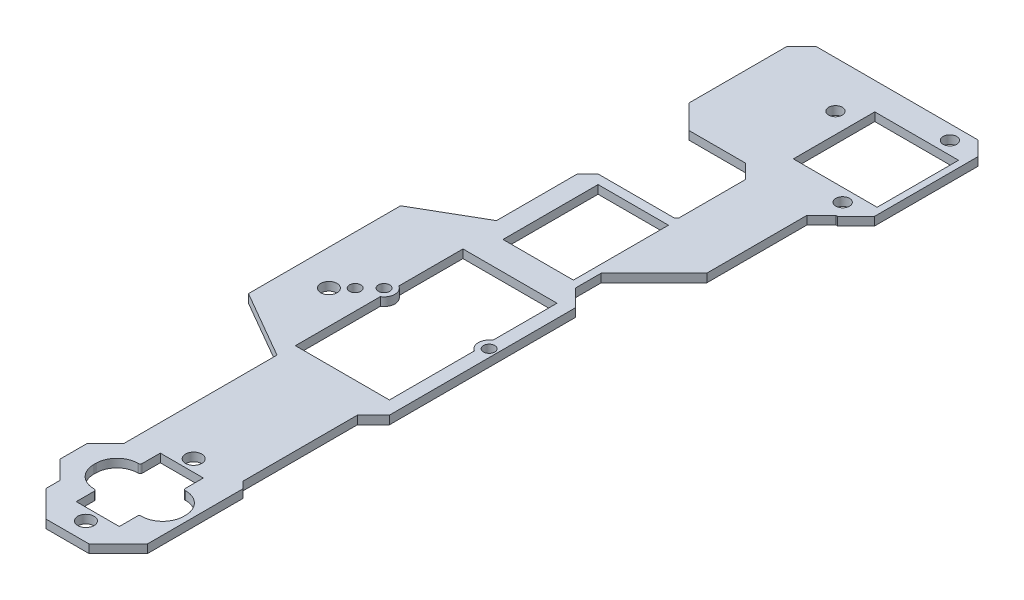
from build123d import *

# Parameters (mm, degrees)
SKETCH_9688_R   = 1.55
SKETCH_9688_R_2 = 1.075
SKETCH_9688_W   = 13.4
SKETCH_9688_H   = 18.1
SKETCH_9688_R_3 = 1.3
SKETCH_9688_W_2 = 15.95
SKETCH_9688_H_2 = 15.5
PCB_DEPTH       = 1.6


with BuildPart() as part:
    # Sketch 9688 → 主结构-PCB最大范围-实际可以比这个小 (new body)
    with BuildSketch(Plane(origin=(0, 0, 0), x_dir=(1, 0, 0), z_dir=(0, 1, 0))):
        Polygon((3.75, 45), (6.5, 42.25), (6.5, 29.683072379), (6, 29.183072379), (-8.425, 29.183072379), (-10.425, 27.183072379), (-10.425, 11.824221247), (-22, 5.141391882), (-22, -23.812684418), (-9.65, -30.942960242), (-9.15, -31.231635377), (-9.15, -34.122764912), (-9.15, -60.451116293), (-12.65, -63.951116293), (-12.65, -69.046082783), (-9.15, -72.546082783), (-9.15, -75.200927376), (-4.100927376, -80.25), (4.100927376, -80.25), (9.65, -74.700927376), (9.65, -56.5), (8.4, -55.25), (8.4, -33.506128091), (11.45, -30.456128091), (11.45, 5.014466094), (8.2, 8.264466094), (8.2, 13.127500889), (18.25, 23.177500889), (18.25, 30.170693918), (18.25, 42.25), (21, 45), (21.35, 45), (24.85, 48.5), (24.85, 68.199999999), (22.1, 70.949999999), (-8.75, 70.949999999), (-11.5, 68.199999999), (-11.5, 49.5), (-7, 45), align=None)
        with Locations(Location((0, -76.75, 0), (0, 0, 270))):
            Circle(SKETCH_9688_R, mode=Mode.SUBTRACT)
        with BuildLine():
            Line((-4.100927376, -61.951116293), (-4.100927376, -58.5))
            Line((-4.100927376, -58.5), (-0.000927376, -58.5))
            Line((-0.000927376, -58.5), (0.000927376, -58.5))
            Line((0.000927376, -58.5), (4.100927376, -58.5))
            Line((4.100927376, -58.5), (4.100927376, -61.951116293))
            ThreePointArc((4.100927376, -61.951116293), (4.203440002, -62.198603667), (4.450927376, -62.301116293))
            Line((4.450927376, -62.301116293), (4.54842161, -62.301116293))
            ThreePointArc((4.54842161, -62.301116293), (7.376848734, -63.472689168), (8.54842161, -66.301116291))
            Line((8.54842161, -66.301116291), (8.54842161, -66.696082786))
            ThreePointArc((8.54842161, -66.696082786), (7.376848734, -69.524509909), (4.54842161, -70.696082783))
            Line((4.54842161, -70.696082783), (4.450927376, -70.696082783))
            ThreePointArc((4.450927376, -70.696082783), (4.203440002, -70.79859541), (4.100927376, -71.046082783))
            Line((4.100927376, -71.046082783), (4.100927376, -74.497199077))
            Line((4.100927376, -74.497199077), (0.000927376, -74.497199077))
            Line((0.000927376, -74.497199077), (-0.000927376, -74.497199077))
            Line((-0.000927376, -74.497199077), (-4.100927376, -74.497199077))
            Line((-4.100927376, -74.497199077), (-4.100927376, -71.046082783))
            ThreePointArc((-4.100927376, -71.046082783), (-4.203440002, -70.79859541), (-4.450927376, -70.696082783))
            Line((-4.450927376, -70.696082783), (-4.54842161, -70.696082783))
            ThreePointArc((-4.54842161, -70.696082783), (-7.376848734, -69.524509909), (-8.54842161, -66.696082786))
            Line((-8.54842161, -66.696082786), (-8.54842161, -66.301116291))
            ThreePointArc((-8.54842161, -66.301116291), (-7.376848734, -63.472689168), (-4.54842161, -62.301116293))
            Line((-4.54842161, -62.301116293), (-4.450927376, -62.301116293))
            ThreePointArc((-4.450927376, -62.301116293), (-4.203440002, -62.198603667), (-4.100927376, -61.951116293))
        make_face(mode=Mode.SUBTRACT)
        with Locations(Location((0, -56.25, 0), (0, 0, 270))):
            Circle(SKETCH_9688_R, mode=Mode.SUBTRACT)
        with Locations(Location((-15.25, -15.25, 0), (0, 0, 270))):
            Circle(SKETCH_9688_R, mode=Mode.SUBTRACT)
        with Locations(Location((-12.75, -12.75, 0), (0, 0, 270))):
            Circle(SKETCH_9688_R_2, mode=Mode.SUBTRACT)
        with Locations(Location((-10, -10, 0), (0, 0, 270))):
            Circle(SKETCH_9688_R_2, mode=Mode.SUBTRACT)
        with BuildLine():
            Line((-8.95, -8.239318314), (-8.95, 3.966927621))
            Line((-8.95, 3.966927621), (8.95, 3.966927621))
            Line((8.95, 3.966927621), (8.95, -8.239318314))
            ThreePointArc((8.95, -8.239318314), (7.95, -10), (8.95, -11.760681686))
            Line((8.95, -11.760681686), (8.95, -27.933072379))
            Line((8.95, -27.933072379), (-8.95, -27.933072379))
            Line((-8.95, -27.933072379), (-8.95, -11.760681686))
            ThreePointArc((-8.95, -11.760681686), (-7.95, -10), (-8.95, -8.239318314))
        make_face(mode=Mode.SUBTRACT)
        with Locations(Location((10, -10, 0), (0, 0, 270))):
            Circle(SKETCH_9688_R_2, mode=Mode.SUBTRACT)
        with Locations((0, 18.383072379)):
            Rectangle(SKETCH_9688_W, SKETCH_9688_H, mode=Mode.SUBTRACT)
        with Locations(Location((3.8, 62.12002051, 0), (0, 0, 270))):
            Circle(SKETCH_9688_R_3, mode=Mode.SUBTRACT)
        with Locations(Location((19.5, 47.800000001, 0), (0, 0, 270))):
            Circle(SKETCH_9688_R_3, mode=Mode.SUBTRACT)
        with Locations((15.625, 58)):
            Rectangle(SKETCH_9688_W_2, SKETCH_9688_H_2, mode=Mode.SUBTRACT)
        with Locations(Location((19.5, 68.199999999, 0), (0, 0, 270))):
            Circle(SKETCH_9688_R_3, mode=Mode.SUBTRACT)
    extrude(amount=PCB_DEPTH)


solid = part.part
